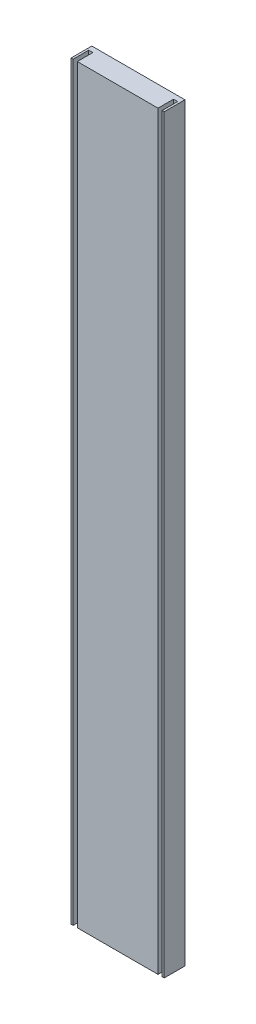
from build123d import *

# Parameters (mm, degrees)
EXTRUDE_1_DEPTH      = 50
EXTRUDE_1_DEPTH_BACK = 675


with BuildPart() as part:
    # Эскиз1 → Бобышка-Вытянуть1 (new, two sides: drawn at the far end of the back side and taken through both)
    with BuildSketch(Plane(origin=(0, 0, 0), x_dir=(1, 0, 0), z_dir=(0, 1, 0)).offset(-EXTRUDE_1_DEPTH_BACK)):
        Polygon((-31.616298812, -7.241086587), (-31.616298812, 7.758913413), (-27.616298812, 7.758913413), (-27.616298812, -7.241086587), (50.383701188, -7.241086587), (50.383701188, 7.758913413), (54.383701188, 7.758913413), (54.383701188, -7.241086587), (56.383701188, -7.241086587), (56.383701188, 12.758913413), (-33.616298812, 12.758913413), (-33.616298812, -7.241086587), align=None)
    extrude(amount=EXTRUDE_1_DEPTH + EXTRUDE_1_DEPTH_BACK)


solid = part.part
